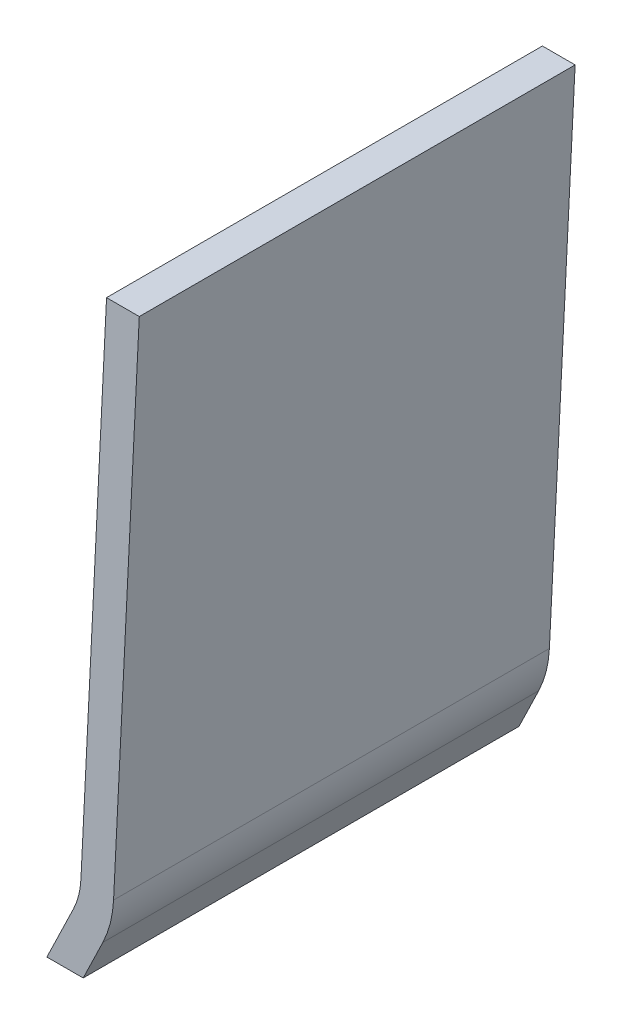
from build123d import *

# Parameters (mm, degrees)
BOSS_EXTRUDE1_DEPTH = 400


with BuildPart() as part:
    # Sketch1 → Boss-Extrude1 (new body)
    with BuildSketch(Plane.XY):
        with BuildLine():
            Line((530.806644997, 551.486677506), (560.843549817, 551.486677506))
            Line((560.843549817, 551.486677506), (537.245180682, 75.874954447))
            ThreePointArc((537.245180682, 75.874954447), (534.25984792, 56.092344011), (527.396286213, 37.29991447))
            Line((527.396286213, 37.29991447), (509.360958332, 0))
            Line((509.360958332, 0), (476.038081202, 0))
            Line((476.038081202, 0), (500.387814031, 50.359103969))
            ThreePointArc((500.387814031, 50.359103969), (505.192307226, 63.513804648), (507.28204016, 77.361631953))
            Line((507.28204016, 77.361631953), (530.806644997, 551.486677506))
        make_face()
    extrude(amount=BOSS_EXTRUDE1_DEPTH)


solid = part.part
